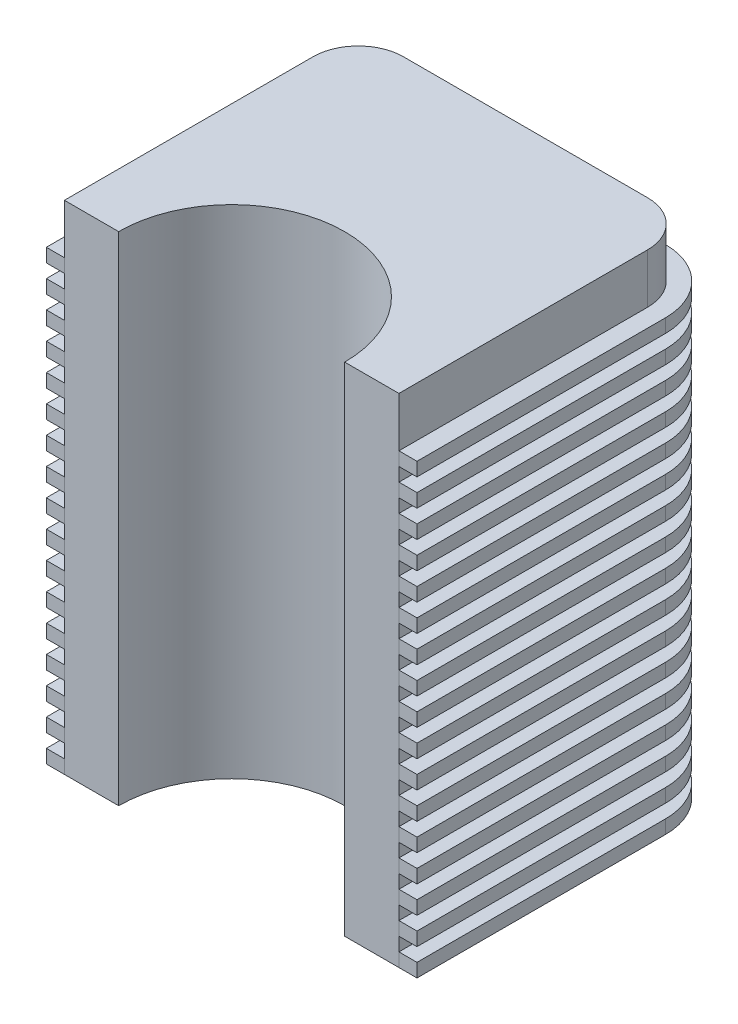
from build123d import *

# Parameters (mm, degrees)
BOSS_EXTRUDE1_DEPTH = 110
BOSS_EXTRUDE3_DEPTH = 3
LPATTERN1_COUNT     = 17
LPATTERN1_PITCH     = 6


with BuildPart() as part:
    # Sketch1 → Boss-Extrude1 (new body)
    with BuildSketch(Plane(origin=(0, 0, 0), x_dir=(1, 0, 0), z_dir=(0, 1, 0))):
        with BuildLine():
            Line((25, 0), (37, 0))
            Line((37, 0), (37, 55))
            ThreePointArc((37, 55), (34.071067812, 62.071067812), (27, 65))
            Line((27, 65), (-27, 65))
            ThreePointArc((-27, 65), (-34.071067812, 62.071067812), (-37, 55))
            Line((-37, 55), (-37, 0))
            Line((-37, 0), (-25, 0))
            ThreePointArc((-25, 0), (0, 25), (25, 0))
        make_face()
    extrude(amount=BOSS_EXTRUDE1_DEPTH)


with BuildPart() as body_2:
    # Sketch3 → Boss-Extrude3 (new body)
    with BuildSketch(Plane(origin=(0, 0, 0), x_dir=(-1, 0, 0), z_dir=(0, -1, 0))):
        with BuildLine():
            Line((27, 69), (-27, 69))
            ThreePointArc((-27, 69), (-36.899494937, 64.899494937), (-41, 55))
            Line((-41, 55), (-41, 0))
            Line((-41, 0), (-37, 0))
            Line((-37, 0), (-37, 55))
            ThreePointArc((-37, 55), (-34.071067812, 62.071067812), (-27, 65))
            Line((-27, 65), (27, 65))
            ThreePointArc((27, 65), (34.071067812, 62.071067812), (37, 55))
            Line((37, 55), (37, 0))
            Line((37, 0), (41, 0))
            Line((41, 0), (41, 55))
            ThreePointArc((41, 55), (36.899494937, 64.899494937), (27, 69))
        make_face()
    boss_extrude3 = extrude(amount=-BOSS_EXTRUDE3_DEPTH)


with BuildPart() as lpattern1_1:
    # LPattern1: Boss-Extrude3 ×17
    with Locations(*[(0, i * LPATTERN1_PITCH, 0) for i in range(1, LPATTERN1_COUNT)]):
        add(boss_extrude3)


solid = Compound([part.part, body_2.part, lpattern1_1.part])
